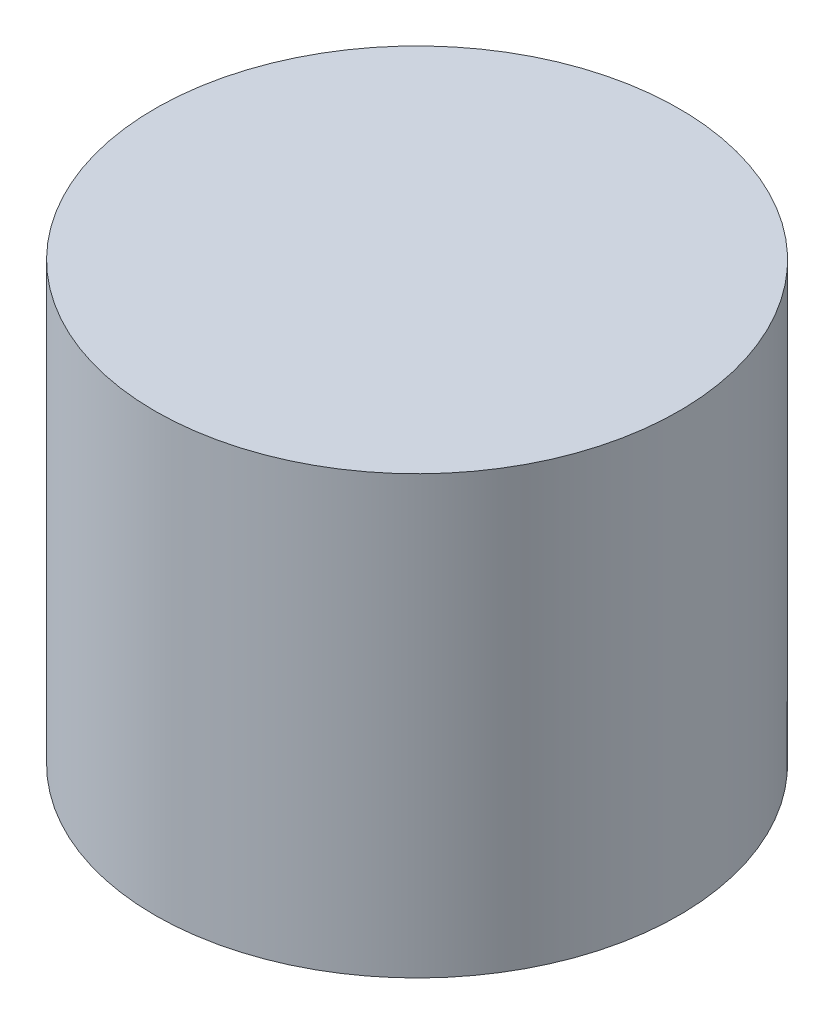
from build123d import *

# Parameters (mm, degrees)
SKETCH1_R           = 3
BOSS_EXTRUDE1_DEPTH = 5


with BuildPart() as part:
    # Sketch1 → Boss-Extrude1 (new body)
    with BuildSketch(Plane(origin=(0, 0, 0), x_dir=(1, 0, 0), z_dir=(0, 1, 0))):
        with Locations(Location((0, 0, 0), (0, 0, 270))):
            Circle(SKETCH1_R)
    extrude(amount=BOSS_EXTRUDE1_DEPTH)


solid = part.part
